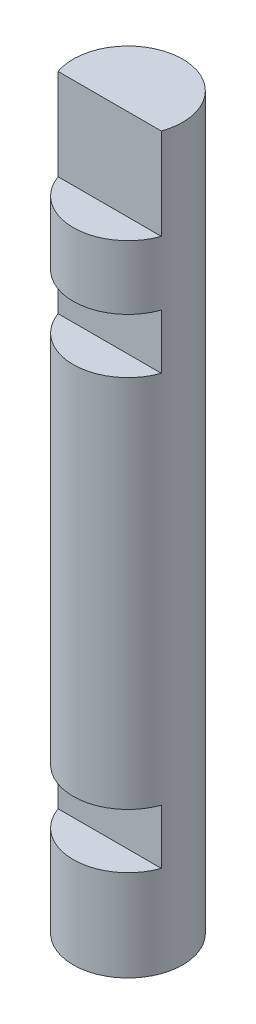
from build123d import *

# Parameters (mm, degrees)
CROQUIS1_R                 = 3
SALIENTE_EXTRUIR1_DEPTH    = 20
CORTAR_EXTRUIR2_DEPTH      = 41.224370722
CORTAR_EXTRUIR2_DEPTH_BACK = 5
CROQUIS3_W                 = 8.224241852
CROQUIS3_H                 = 2
CROQUIS8_W                 = 6
CROQUIS8_H                 = 3
CORTAR_EXTRUIR4_DEPTH      = 10


with BuildPart() as part:
    # Croquis1 → Saliente-Extruir1 (new, symmetric)
    with BuildSketch(Plane(origin=(0, 0, 0), x_dir=(1, 0, 0), z_dir=(0, 1, 0))):
        Circle(CROQUIS1_R)
    extrude(amount=SALIENTE_EXTRUIR1_DEPTH, both=True)

    # Croquis3 → Cortar-Extruir2 (cut, two sides: drawn at the far end of the back side and taken through both)
    with BuildSketch(Plane(origin=(0, 20, 0), x_dir=(1, 0, 0), z_dir=(0, 1, 0)).offset(-CORTAR_EXTRUIR2_DEPTH_BACK)):
        with Locations((0.237694851, -2)):
            Rectangle(CROQUIS3_W, CROQUIS3_H)
    extrude(amount=CORTAR_EXTRUIR2_DEPTH + CORTAR_EXTRUIR2_DEPTH_BACK, mode=Mode.SUBTRACT)

    # Croquis8 → Cortar-Extruir4 (cut)
    with BuildSketch(Plane.XY.offset(1)):
        with Locations((0, 10)):
            Rectangle(CROQUIS8_W, CROQUIS8_H)
        with Locations((0, -13.5)):
            Rectangle(CROQUIS8_W, CROQUIS8_H)
    extrude(amount=CORTAR_EXTRUIR4_DEPTH, mode=Mode.SUBTRACT)


solid = part.part
